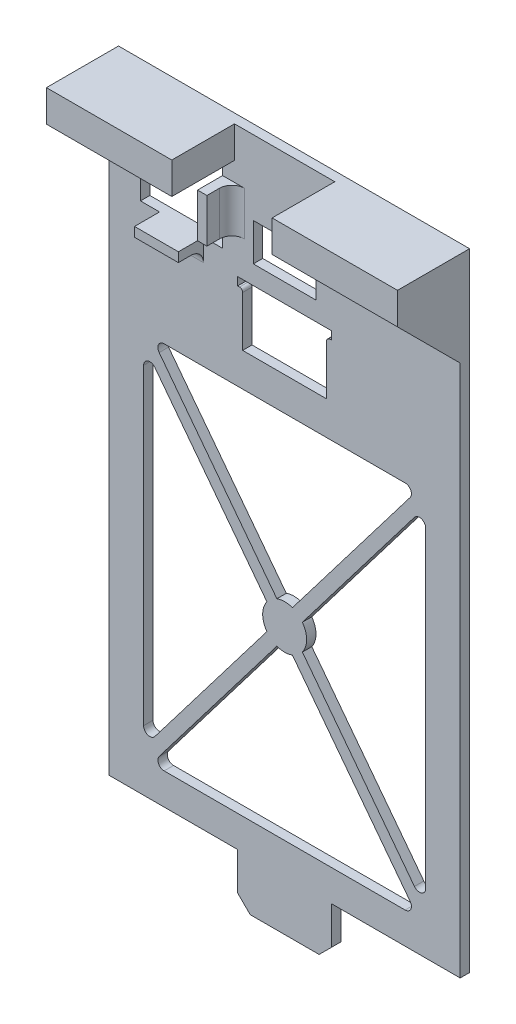
from build123d import *

# Parameters (mm, degrees)
SKETCH1_W           = 56
SKETCH1_H           = 100
BOSS_EXTRUDE1_DEPTH = 1.5
SKETCH2_W           = 20
SKETCH2_H           = 5.05
BOSS_EXTRUDE2_DEPTH = 10
SKETCH3_W           = 13.1
SKETCH3_H           = 13.1
CUT_EXTRUDE1_DEPTH  = 112.005866962
BOSS_EXTRUDE3_DEPTH = 5
BOSS_EXTRUDE4_DEPTH = 5
SKETCH6_W           = 7
SKETCH6_H           = 1.5
SKETCH6_W_2         = 1.5
SKETCH6_H_2         = 7
BOSS_EXTRUDE5_DEPTH = 4
SKETCH7_W           = 15
SKETCH7_H           = 1.3
CUT_EXTRUDE2_DEPTH  = 112.005866962
SKETCH8_W           = 13.4
SKETCH8_H           = 8.5
SKETCH8_W_2         = 10
SKETCH8_H_2         = 6
CUT_EXTRUDE3_DEPTH  = 112.005866962
FILLET1_R           = 2
SKETCH9_W           = 15
SKETCH9_H           = 8
BOSS_EXTRUDE6_DEPTH = 1.5
CHAMFER1_SIZE       = 2
SKETCH10_W          = 45
SKETCH10_H          = 59
CUT_EXTRUDE4_DEPTH  = 4
BOSS_EXTRUDE7_DEPTH = 1.5
FILLET2_R           = 1
FILLET3_R           = 0.5


with BuildPart() as part:
    # Sketch1 → Boss-Extrude1 (new body)
    with BuildSketch(Plane.XY):
        with Locations((0, -56.95)):
            Rectangle(SKETCH1_W, SKETCH1_H)
    extrude(amount=BOSS_EXTRUDE1_DEPTH)

    # Sketch2 → Boss-Extrude2 (add)
    with BuildSketch(Plane.XY.offset(1.5)):
        with Locations((-18, -9.475)):
            Rectangle(SKETCH2_W, SKETCH2_H)
        with Locations((18, -9.475)):
            Rectangle(SKETCH2_W, SKETCH2_H)
    extrude(amount=BOSS_EXTRUDE2_DEPTH)

    # Sketch3 → Cut-Extrude1 (cut, through all)
    with BuildSketch(Plane.XY.offset(1.5)):
        with Locations((-16.45, -18.55)):
            Rectangle(SKETCH3_W, SKETCH3_H)
    extrude(amount=-CUT_EXTRUDE1_DEPTH, mode=Mode.SUBTRACT)

    # Sketch4 → Boss-Extrude3 (add)
    with BuildSketch(Plane(origin=(28, 0, 0), x_dir=(0, 0, -1), z_dir=(1, 0, 0))):
        Polygon((-11.5, -12), (-1.5, -12), (-1.5, -22), align=None)
    extrude(amount=-BOSS_EXTRUDE3_DEPTH)

    # Sketch5 → Boss-Extrude4 (add)
    with BuildSketch(Plane.ZY.offset(28)):
        Polygon((1.5, -22), (11.5, -12), (1.5, -12), align=None)
    extrude(amount=-BOSS_EXTRUDE4_DEPTH)

    # Sketch6 → Boss-Extrude5 (add)
    with BuildSketch(Plane.XY.offset(1.5)):
        with Locations((-16.45, -25.85)):
            Rectangle(SKETCH6_W, SKETCH6_H)
        with Locations((-9.15, -18.55)):
            Rectangle(SKETCH6_W_2, SKETCH6_H_2)
    extrude(amount=BOSS_EXTRUDE5_DEPTH)

    # Sketch7 → Cut-Extrude2 (cut, through all)
    with BuildSketch(Plane.XY.offset(1.5)):
        with Locations((0, -28.45)):
            Rectangle(SKETCH7_W, SKETCH7_H)
    extrude(amount=-CUT_EXTRUDE2_DEPTH, mode=Mode.SUBTRACT)

    # Sketch8 → Cut-Extrude3 (cut, through all)
    with BuildSketch(Plane.XY.offset(1.5)):
        with Locations((0, -33.35)):
            Rectangle(SKETCH8_W, SKETCH8_H)
        with Locations((0, -21.8)):
            Rectangle(SKETCH8_W_2, SKETCH8_H_2)
    extrude(amount=-CUT_EXTRUDE3_DEPTH, mode=Mode.SUBTRACT)

    # Fillet1
    fillet1_edges = [part.edges().sort_by_distance(p)[0] for p in [
        (-16.45, -26.6, 1.5),
        (-8.4, -18.55, 1.5),
    ]]
    fillet(fillet1_edges, radius=FILLET1_R)

    # Sketch9 → Boss-Extrude6 (add)
    with BuildSketch(Plane.XY.offset(1.5)):
        with Locations((0, -110.95)):
            Rectangle(SKETCH9_W, SKETCH9_H)
    extrude(amount=-BOSS_EXTRUDE6_DEPTH)

    # Chamfer1
    chamfer1_edges = [part.edges().sort_by_distance(p)[0] for p in [
        (-7.5, -114.95, 0.75),
        (7.5, -114.95, 0.75),
    ]]
    chamfer(chamfer1_edges, length=CHAMFER1_SIZE)

    # Sketch10 → Cut-Extrude4 (cut)
    with BuildSketch(Plane.XY.offset(1.5)):
        with Locations((0, -72.45)):
            Rectangle(SKETCH10_W, SKETCH10_H)
    extrude(amount=-CUT_EXTRUDE4_DEPTH, mode=Mode.SUBTRACT)

    # Sketch11 → Boss-Extrude7 (add)
    with BuildSketch(Plane.XY.offset(1.5)):
        with BuildLine():
            Line((-21.242331765, -42.95), (-22.5, -42.95))
            Line((-22.5, -42.95), (-22.5, -44.598942796))
            Line((-22.5, -44.598942796), (-2.829214626, -70.389528064))
            ThreePointArc((-2.829214626, -70.389528064), (-2.122572116, -69.667072115), (-1.238970121, -69.176629712))
            Line((-1.238970121, -69.176629712), (-21.242331765, -42.95))
        make_face()
        with BuildLine():
            Line((22.5, -42.95), (21.242331765, -42.95))
            Line((21.242331765, -42.95), (1.238970121, -69.176629712))
            ThreePointArc((1.238970121, -69.176629712), (2.122572116, -69.667072115), (2.829214626, -70.389528064))
            Line((2.829214626, -70.389528064), (22.5, -44.598942796))
            Line((22.5, -44.598942796), (22.5, -42.95))
        make_face()
        with BuildLine():
            Line((22.5, -100.301057204), (2.829214626, -74.510471936))
            ThreePointArc((2.829214626, -74.510471936), (2.122572116, -75.232927885), (1.238970121, -75.723370288))
            Line((1.238970121, -75.723370288), (21.242331765, -101.95))
            Line((21.242331765, -101.95), (22.5, -101.95))
            Line((22.5, -101.95), (22.5, -100.301057204))
        make_face()
        with BuildLine():
            Line((-2.829214626, -74.510471936), (-22.5, -100.301057204))
            Line((-22.5, -100.301057204), (-22.5, -101.95))
            Line((-22.5, -101.95), (-21.242331765, -101.95))
            Line((-21.242331765, -101.95), (-1.238970121, -75.723370288))
            ThreePointArc((-1.238970121, -75.723370288), (-2.122572116, -75.232927885), (-2.829214626, -74.510471936))
        make_face()
        with BuildLine():
            Line((-1.257668235, -72.45), (-2.829214626, -70.389528064))
            ThreePointArc((-2.829214626, -70.389528064), (-3.5, -72.45), (-2.829214626, -74.510471936))
            Line((-2.829214626, -74.510471936), (-1.257668235, -72.45))
        make_face()
        with BuildLine():
            Line((0, -70.801057204), (-1.238970121, -69.176629712))
            ThreePointArc((-1.238970121, -69.176629712), (-2.122572116, -69.667072115), (-2.829214626, -70.389528064))
            Line((-2.829214626, -70.389528064), (-1.257668235, -72.45))
            Line((-1.257668235, -72.45), (0, -70.801057204))
        make_face()
        with BuildLine():
            Line((0, -74.098942796), (-1.257668235, -72.45))
            Line((-1.257668235, -72.45), (-2.829214626, -74.510471936))
            ThreePointArc((-2.829214626, -74.510471936), (-2.122572116, -75.232927885), (-1.238970121, -75.723370288))
            Line((-1.238970121, -75.723370288), (0, -74.098942796))
        make_face()
        with BuildLine():
            Line((1.238970121, -75.723370288), (0, -74.098942796))
            Line((0, -74.098942796), (-1.238970121, -75.723370288))
            ThreePointArc((-1.238970121, -75.723370288), (0, -75.95), (1.238970121, -75.723370288))
        make_face()
        with BuildLine():
            Line((2.829214626, -70.389528064), (1.257668235, -72.45))
            Line((1.257668235, -72.45), (2.829214626, -74.510471936))
            ThreePointArc((2.829214626, -74.510471936), (3.328081369, -73.533454846), (3.5, -72.45))
            ThreePointArc((3.5, -72.45), (3.328081369, -71.366545154), (2.829214626, -70.389528064))
        make_face()
        with BuildLine():
            Line((2.829214626, -74.510471936), (1.257668235, -72.45))
            Line((1.257668235, -72.45), (0, -74.098942796))
            Line((0, -74.098942796), (1.238970121, -75.723370288))
            ThreePointArc((1.238970121, -75.723370288), (2.122572116, -75.232927885), (2.829214626, -74.510471936))
        make_face()
        with BuildLine():
            Line((1.238970121, -69.176629712), (0, -70.801057204))
            Line((0, -70.801057204), (1.257668235, -72.45))
            Line((1.257668235, -72.45), (2.829214626, -70.389528064))
            ThreePointArc((2.829214626, -70.389528064), (2.122572116, -69.667072115), (1.238970121, -69.176629712))
        make_face()
        with BuildLine():
            ThreePointArc((1.238970121, -69.176629712), (0, -68.95), (-1.238970121, -69.176629712))
            Line((-1.238970121, -69.176629712), (0, -70.801057204))
            Line((0, -70.801057204), (1.238970121, -69.176629712))
        make_face()
        Polygon((1.257668235, -72.45), (0, -70.801057204), (-1.257668235, -72.45), (0, -74.098942796), align=None)
    extrude(amount=-BOSS_EXTRUDE7_DEPTH)

    # Fillet2
    fillet2_edges = [part.edges().sort_by_distance(p)[0] for p in [
        (-22.5, -100.301057204, 0.75),
        (-21.242331765, -101.95, 0.75),
        (21.242331765, -101.95, 0.75),
        (22.5, -100.301057204, 0.75),
        (22.5, -44.598942796, 0.75),
        (21.242331765, -42.95, 0.75),
        (-21.242331765, -42.95, 0.75),
        (-22.5, -44.598942796, 0.75),
    ]]
    fillet(fillet2_edges, radius=FILLET2_R)

    # Fillet3
    fillet3_edges = [part.edges().sort_by_distance(p)[0] for p in [
        (6.7, -29.1, 0.75),
        (-6.7, -29.1, 0.75),
    ]]
    fillet(fillet3_edges, radius=FILLET3_R)


solid = part.part
